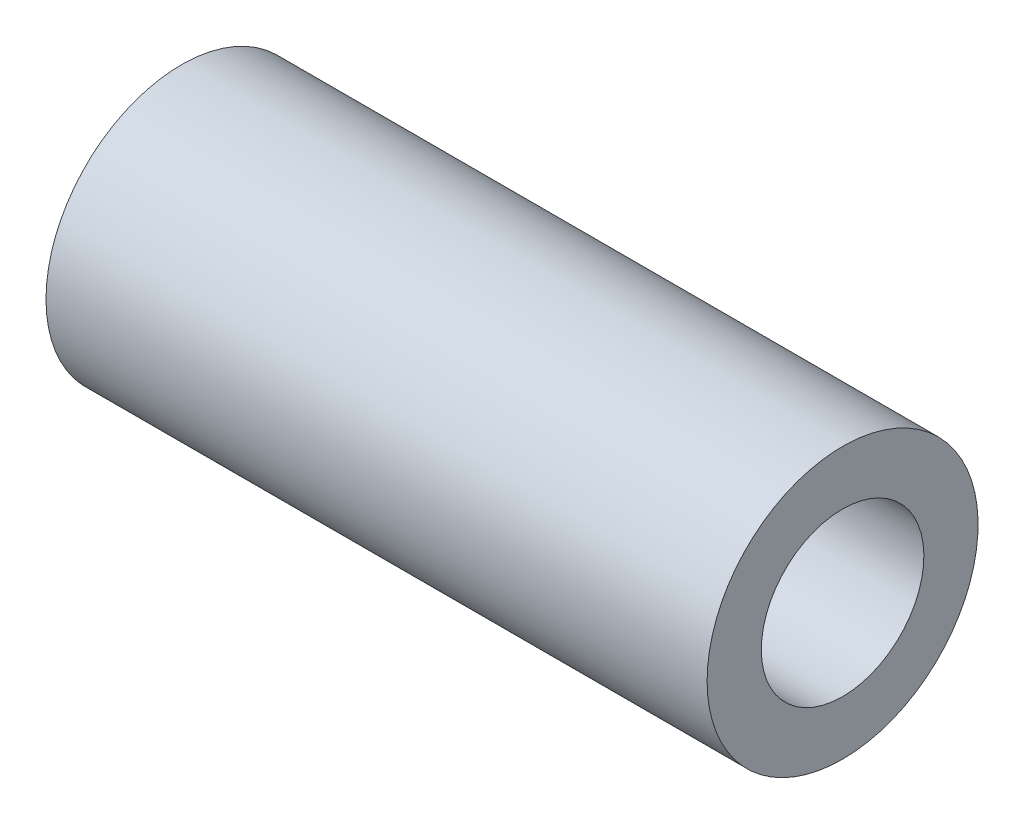
from build123d import *

# Parameters (mm, degrees)
SKETCH1_R           = 2.5
SKETCH1_R_2         = 1.5
BOSS_EXTRUDE1_DEPTH = 12.2


with BuildPart() as part:
    # Sketch1 → Boss-Extrude1 (new body)
    with BuildSketch(Plane.ZY.offset(0.45)):
        with Locations((-94.771057975, 130.531151206)):
            Circle(SKETCH1_R)
        with Locations(Location((-94.771057975, 130.531151206, 0), (0, 0, 199.872118731))):
            Circle(SKETCH1_R_2, mode=Mode.SUBTRACT)
    extrude(amount=BOSS_EXTRUDE1_DEPTH)


solid = part.part
